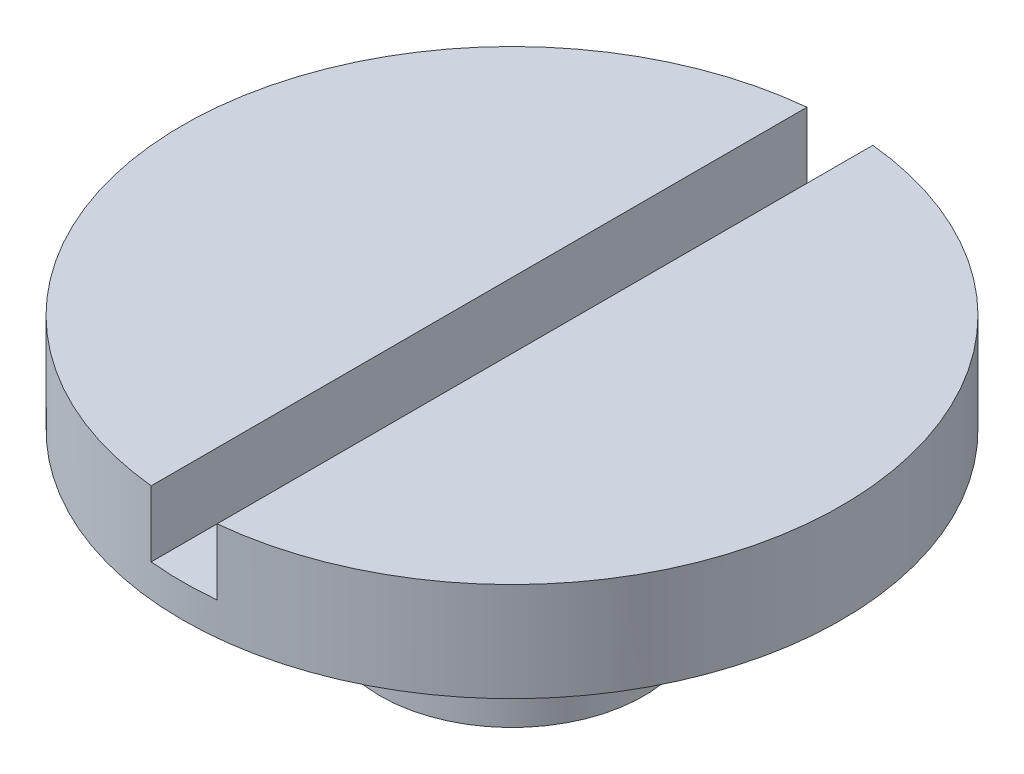
from build123d import *

# Parameters (mm, degrees)
SKETCH1_R           = 50
BOSS_EXTRUDE1_DEPTH = 15
CUT_EXTRUDE1_START  = -10
CUT_EXTRUDE1_DEPTH  = 10
SKETCH3_R           = 20
BOSS_EXTRUDE2_DEPTH = 25


with BuildPart() as part:
    # Sketch1 → Boss-Extrude1 (new body)
    with BuildSketch(Plane(origin=(0, 0, 0), x_dir=(1, 0, 0), z_dir=(0, 1, 0))):
        with Locations(Location((0, 0, 0), (0, 0, 270))):
            Circle(SKETCH1_R)
    extrude(amount=BOSS_EXTRUDE1_DEPTH)

    # Sketch2 → Cut-Extrude1 (cut)
    with BuildSketch(Plane(origin=(0, 15, 0), x_dir=(1, 0, 0), z_dir=(0, 1, 0)).offset(CUT_EXTRUDE1_START)):
        with BuildLine():
            Line((-5, 49.749371855), (-5, -49.749371855))
            ThreePointArc((-5, -49.749371855), (0, -50), (5, -49.749371855))
            Line((5, -49.749371855), (5, 49.749371855))
            ThreePointArc((5, 49.749371855), (0, 50), (-5, 49.749371855))
        make_face()
    extrude(amount=CUT_EXTRUDE1_DEPTH, mode=Mode.SUBTRACT)

    # Sketch3 → Boss-Extrude2 (add)
    with BuildSketch(Plane.XZ):
        with Locations(Location((0, 0, 0), (0, 0, 90))):
            Circle(SKETCH3_R)
        with BuildLine():
            Line((3, 18.696938457), (3, 14.696938457))
            ThreePointArc((3, 14.696938457), (11.618950039, 9.486832981), (15, 0))
            ThreePointArc((15, 0), (-9.486832981, -11.618950039), (-3, 14.696938457))
            Line((-3, 14.696938457), (-3, 18.696938457))
            Line((-3, 18.696938457), (3, 18.696938457))
        make_face(mode=Mode.SUBTRACT)
    extrude(amount=BOSS_EXTRUDE2_DEPTH)


solid = part.part
